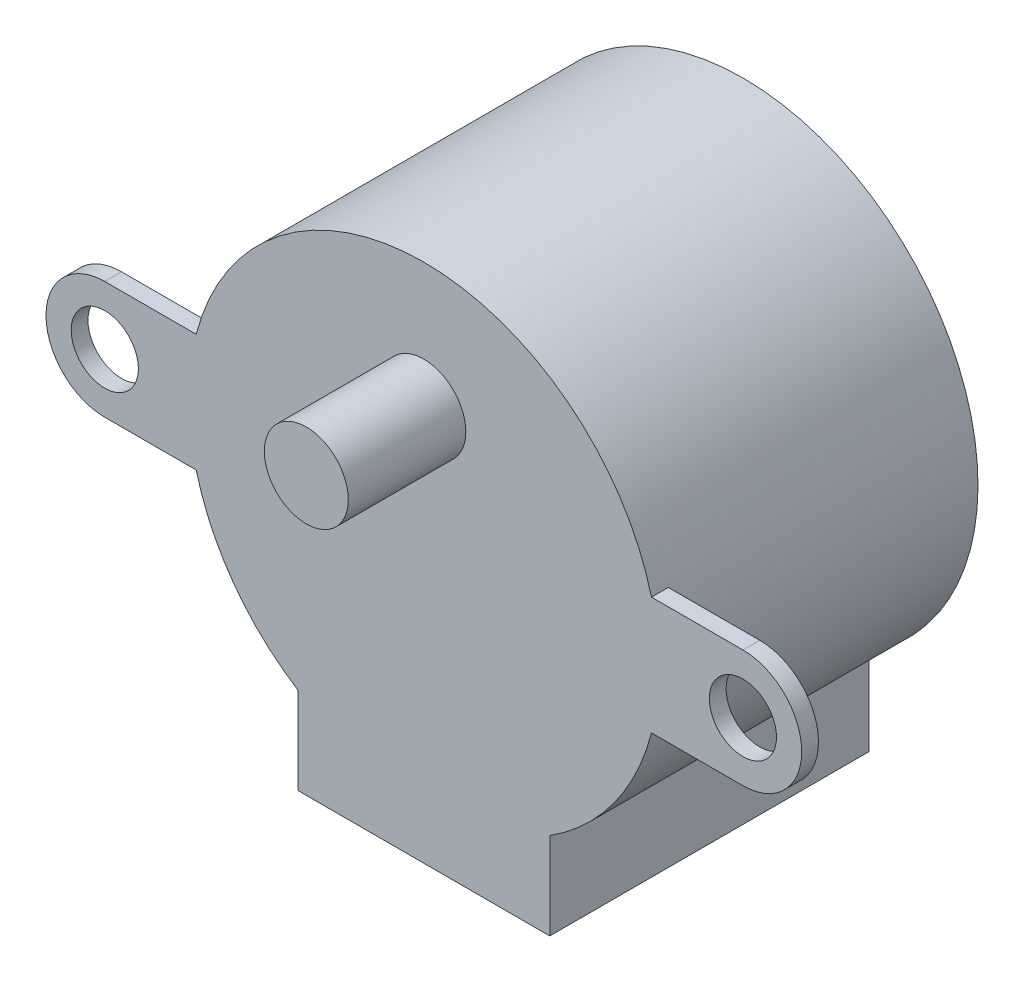
from build123d import *
from build123d.topology import SkipClean

# Parameters (mm, degrees)
ESBO_O1_R                = 2
RESSALTO_EXTRUS_O1_DEPTH = 19
CORTE_EXTRUS_O1_DEPTH    = 18
ESBO_O3_R                = 2.5
RESSALTO_EXTRUS_O2_DEPTH = 7


with BuildPart() as part:
    # Esboço1 → Ressalto-extrusão1 (new body)
    with BuildSketch(Plane.XY):
        with BuildLine():
            Line((19, 3.5), (13.555441712, 3.5))
            ThreePointArc((13.555441712, 3.5), (0, 14), (-13.555441712, 3.5))
            Line((-13.555441712, 3.5), (-19, 3.5))
            ThreePointArc((-19, 3.5), (-22.5, 0), (-19, -3.5))
            Line((-19, -3.5), (-13.555441712, -3.5))
            ThreePointArc((-13.555441712, -3.5), (-11.320120282, -8.237407166), (-7.5, -11.821590418))
            Line((-7.5, -11.821590418), (-7.5, -14))
            Line((-7.5, -14), (-7.5, -17))
            Line((-7.5, -17), (7.5, -17))
            Line((7.5, -17), (7.5, -14))
            Line((7.5, -14), (7.5, -11.821590418))
            ThreePointArc((7.5, -11.821590418), (11.320120282, -8.237407166), (13.555441712, -3.5))
            Line((13.555441712, -3.5), (19, -3.5))
            ThreePointArc((19, -3.5), (22.5, 0), (19, 3.5))
        make_face()
        with Locations((19, 0)):
            Circle(ESBO_O1_R, mode=Mode.SUBTRACT)
        with Locations(Location((-19, 0, 0), (0, 0, 180))):
            Circle(ESBO_O1_R, mode=Mode.SUBTRACT)
    extrude(amount=RESSALTO_EXTRUS_O1_DEPTH)

    # Esboço2 → Corte-extrusão1 (cut)
    with SkipClean():  # the faces are left unmerged after this step: merging them gives an invalid solid
        with BuildSketch(Plane(origin=(0, 0, 0), x_dir=(-1, 0, 0), z_dir=(0, 0, -1))):
            with BuildLine():
                Line((13.555441712, 3.5), (23.80699558, 3.5))
                Line((23.80699558, 3.5), (23.80699558, -3.5))
                Line((23.80699558, -3.5), (13.555441712, -3.5))
                ThreePointArc((13.555441712, -3.5), (14, 0), (13.555441712, 3.5))
            make_face()
            with BuildLine():
                Line((-13.555441712, 3.5), (-24.760546325, 3.5))
                Line((-24.760546325, 3.5), (-24.760546325, -3.5))
                Line((-24.760546325, -3.5), (-13.555441712, -3.5))
                ThreePointArc((-13.555441712, -3.5), (-14, 0), (-13.555441712, 3.5))
            make_face()
        extrude(amount=-CORTE_EXTRUS_O1_DEPTH, mode=Mode.SUBTRACT)

    # Esboço3 → Ressalto-extrusão2 (add)
    with SkipClean():  # the faces are left unmerged after this step: merging them gives an invalid solid
        with BuildSketch(Plane.XY.offset(19)):
            with Locations((0, 6.5)):
                Circle(ESBO_O3_R)
        extrude(amount=RESSALTO_EXTRUS_O2_DEPTH)


solid = part.part
